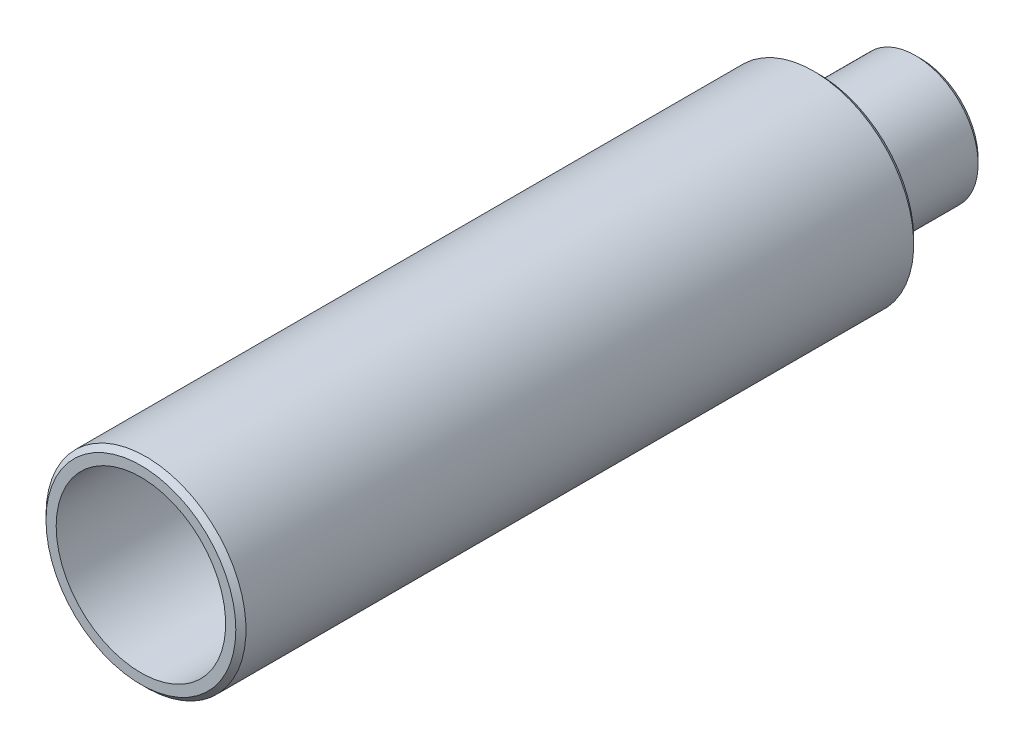
from build123d import *


with BuildPart() as part:
    # Эскиз1 → Повернуть1 (revolve)
    with BuildSketch(Plane(origin=(0, 0, 0), x_dir=(1, 0, 0), z_dir=(0, 1, 0)), mode=Mode.PRIVATE) as revolve_1_sk:
        Polygon((5, -2.5), (5, -40), (5.6, -40), (5.9, -39.7), (5.9, -0.3), (5.6, 0), (3.7, 0), (3.7, 5.7), (3.4, 6), (3, 6), (3, 2.5), (1.85, 2.5), (1.55, 2.2), (1.55, 0), (1.55, -1.2), (2.85, -2.5), align=None)
    revolve(revolve_1_sk.sketch.rotate(Axis((0, 0, 0), (0, 0, 1)), 180), axis=Axis((0, 0, 0), (0, 0, 1)))


solid = part.part
